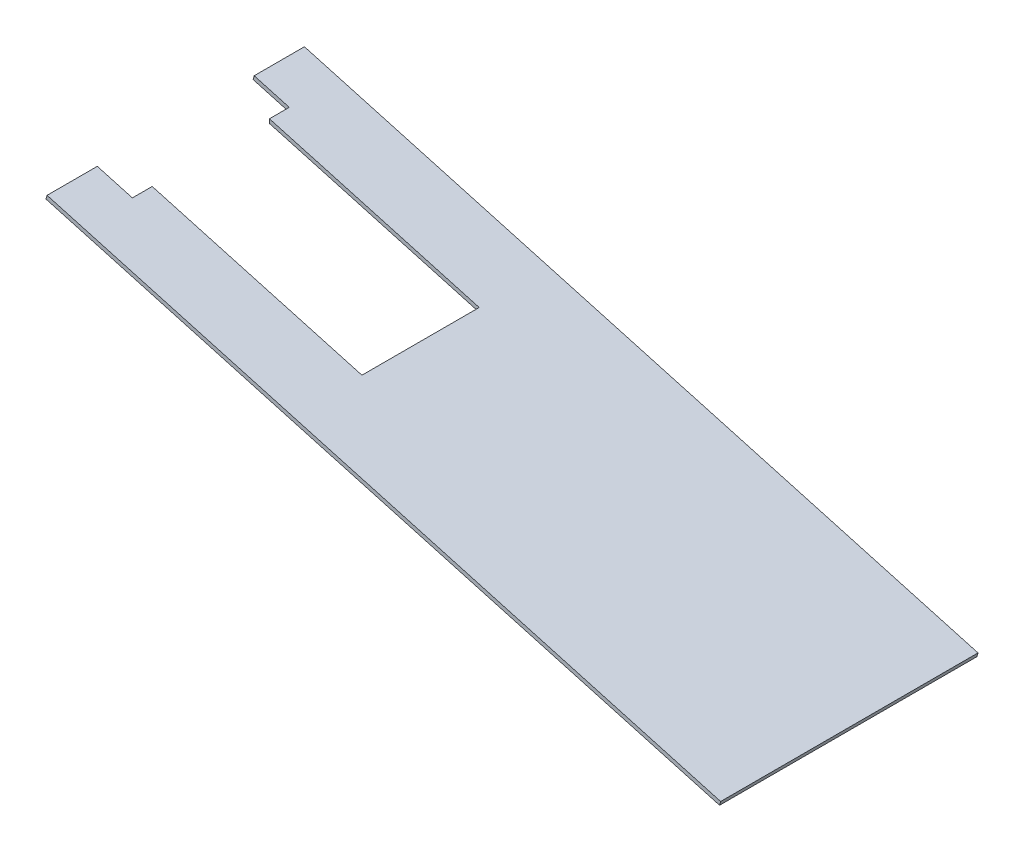
from build123d import *

# Parameters (mm, degrees)
BOSS_EXTRU_1_DEPTH      = 130
ESQUISSE2_W             = 2
ESQUISSE2_H             = 130
BOSS_EXTRU_2_DEPTH      = 96
ESQUISSE3_W             = 79.24305049
ESQUISSE3_H             = 150.673405859
ENL_V_MAT_EXTRU_1_DEPTH = 200
SKETCH1_W               = 504.296840386
SKETCH1_H               = 634.364351256
CUT_EXTRUDE1_DEPTH      = 345.11586261
SKETCH2_W               = 74.041478535
SKETCH2_H               = 186.425865598
CUT_EXTRUDE3_DEPTH      = 293.644673853
SKETCH3_W               = 110
SKETCH3_H               = 59.24305049
CUT_EXTRUDE4_DEPTH      = 293.644673853


with BuildPart() as part:
    # Esquisse1 → Boss.-Extru.1 (new body)
    with BuildSketch(Plane.XY):
        with BuildLine():
            Line((-99.346696614, 52.867973953), (258.521314081, -47.095157526))
            Line((258.521314081, -47.095157526), (259.05937636, -45.168894568))
            Line((259.05937636, -45.168894568), (-98.808634335, 54.794236911))
            ThreePointArc((-98.808634335, 54.794236911), (-99.208409273, 54.877062462), (-99.615727753, 54.904842474))
            Line((-99.615727753, 54.904842474), (-260.478685919, 54.904842474))
            ThreePointArc((-260.478685919, 54.904842474), (-262.600006262, 54.026162817), (-263.478685919, 51.904842474))
            Line((-263.478685919, 51.904842474), (-263.478685919, -47.095157526))
            Line((-263.478685919, -47.095157526), (-261.478685919, -47.095157526))
            Line((-261.478685919, -47.095157526), (-261.478685919, 51.904842474))
            ThreePointArc((-261.478685919, 51.904842474), (-261.1857927, 52.611949255), (-260.478685919, 52.904842474))
            Line((-260.478685919, 52.904842474), (-99.615727753, 52.904842474))
            ThreePointArc((-99.615727753, 52.904842474), (-99.479954927, 52.89558247), (-99.346696614, 52.867973953))
        make_face()
    extrude(amount=BOSS_EXTRU_1_DEPTH)

    # Esquisse2 → Boss.-Extru.2 (add)
    with BuildSketch(Plane.XZ.offset(47.095157526)):
        with Locations((-262.478685919, 65)):
            Rectangle(ESQUISSE2_W, ESQUISSE2_H)
    extrude(amount=BOSS_EXTRU_2_DEPTH)

    # Esquisse3 → Enlèv. mat.-Extru.1 (cut)
    with BuildSketch(Plane.ZY.offset(263.478685919)):
        with Locations((65, -17.758454597)):
            Rectangle(ESQUISSE3_W, ESQUISSE3_H)
    extrude(amount=-ENL_V_MAT_EXTRU_1_DEPTH, mode=Mode.SUBTRACT)

    # Sketch1 → Cut-Extrude1 (cut, through all)
    with BuildSketch(Plane(origin=(7.046316972, 25.225814758, 0), x_dir=(0.9631314790964218, -0.2690311394124084, 0), z_dir=(0.2690311394124084, 0.9631314790964218, 0))):
        with Locations((-363.353604044, 147.785884009)):
            Rectangle(SKETCH1_W, SKETCH1_H)
    extrude(amount=-CUT_EXTRUDE1_DEPTH, mode=Mode.SUBTRACT)

    # Sketch2 → Cut-Extrude3 (cut, through all)
    with BuildSketch(Plane(origin=(7.046316972, 25.225814758, 0), x_dir=(0.9631314790964218, -0.2690311394124084, 0), z_dir=(0.2690311394124084, 0.9631314790964218, 0))):
        with Locations((-128.650675605, -53.320838207)):
            Rectangle(SKETCH2_W, SKETCH2_H)
    extrude(amount=-CUT_EXTRUDE3_DEPTH, mode=Mode.SUBTRACT)

    # Sketch3 → Cut-Extrude4 (cut, through all)
    with BuildSketch(Plane(origin=(7.046316972, 25.225814758, 0), x_dir=(0.9631314790964218, -0.2690311394124084, 0), z_dir=(0.2690311394124084, 0.9631314790964218, 0))):
        with Locations((-18.224688862, -65)):
            Rectangle(SKETCH3_W, SKETCH3_H)
    extrude(amount=-CUT_EXTRUDE4_DEPTH, mode=Mode.SUBTRACT)


solid = part.part
